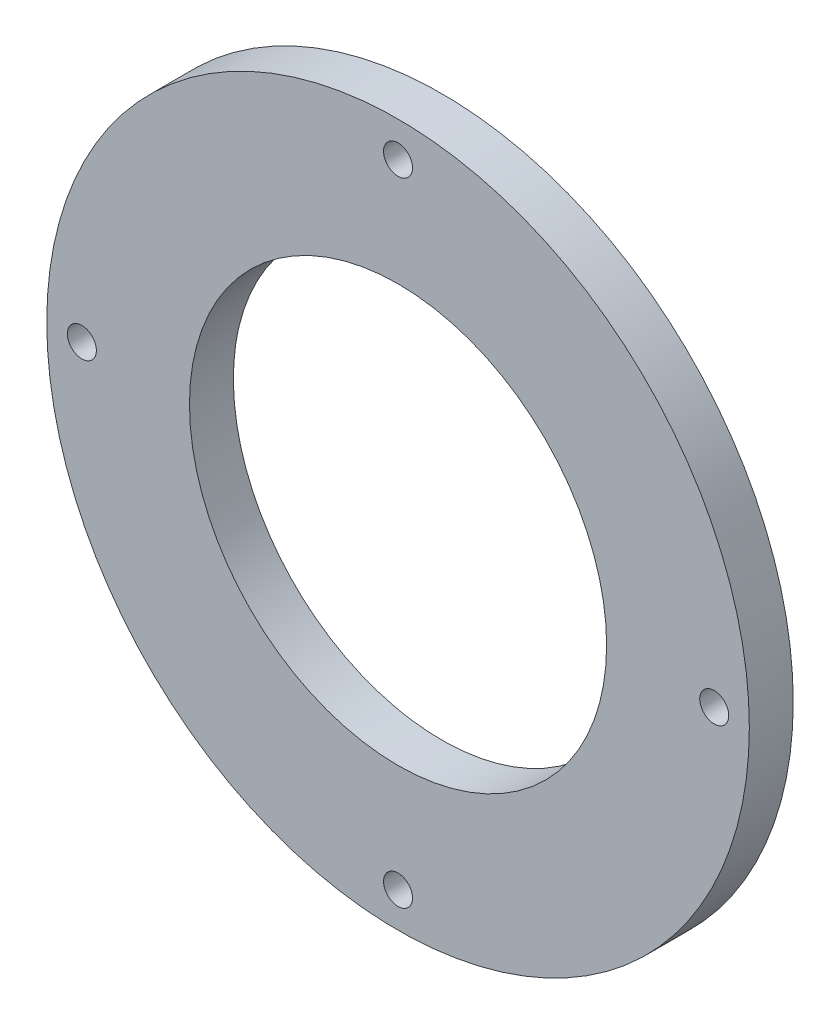
from build123d import *

# Parameters (mm, degrees)
ESKIZ_KONTUR_R        = 40
PLASTINA_DEPTH        = 5
OTVERSTIYA_DEPTH      = 57.789083458
OTVERSTIYA_DEPTH_BACK = 57.789083458
ESKIZ_OTVERSTIYA_R    = 1.65
ESKIZ_OTVERSTIYA_R_2  = 23.75


with BuildPart() as part:
    # Eskiz_kontur → Plastina (new body)
    with BuildSketch(Plane.XY):
        Circle(ESKIZ_KONTUR_R)
    extrude(amount=PLASTINA_DEPTH)

    # Eskiz_otverstiya → Otverstiya (cut, two sides: drawn at the far end of the back side and taken through both)
    with BuildSketch(Plane.XY.offset(-OTVERSTIYA_DEPTH_BACK)):
        with Locations((0, -36)):
            Circle(ESKIZ_OTVERSTIYA_R)
        Circle(ESKIZ_OTVERSTIYA_R_2)
        with Locations((-36, 0)):
            Circle(ESKIZ_OTVERSTIYA_R)
        with Locations((36, 0)):
            Circle(ESKIZ_OTVERSTIYA_R)
        with Locations((0, 36)):
            Circle(ESKIZ_OTVERSTIYA_R)
    extrude(amount=OTVERSTIYA_DEPTH + OTVERSTIYA_DEPTH_BACK, mode=Mode.SUBTRACT)


solid = part.part
